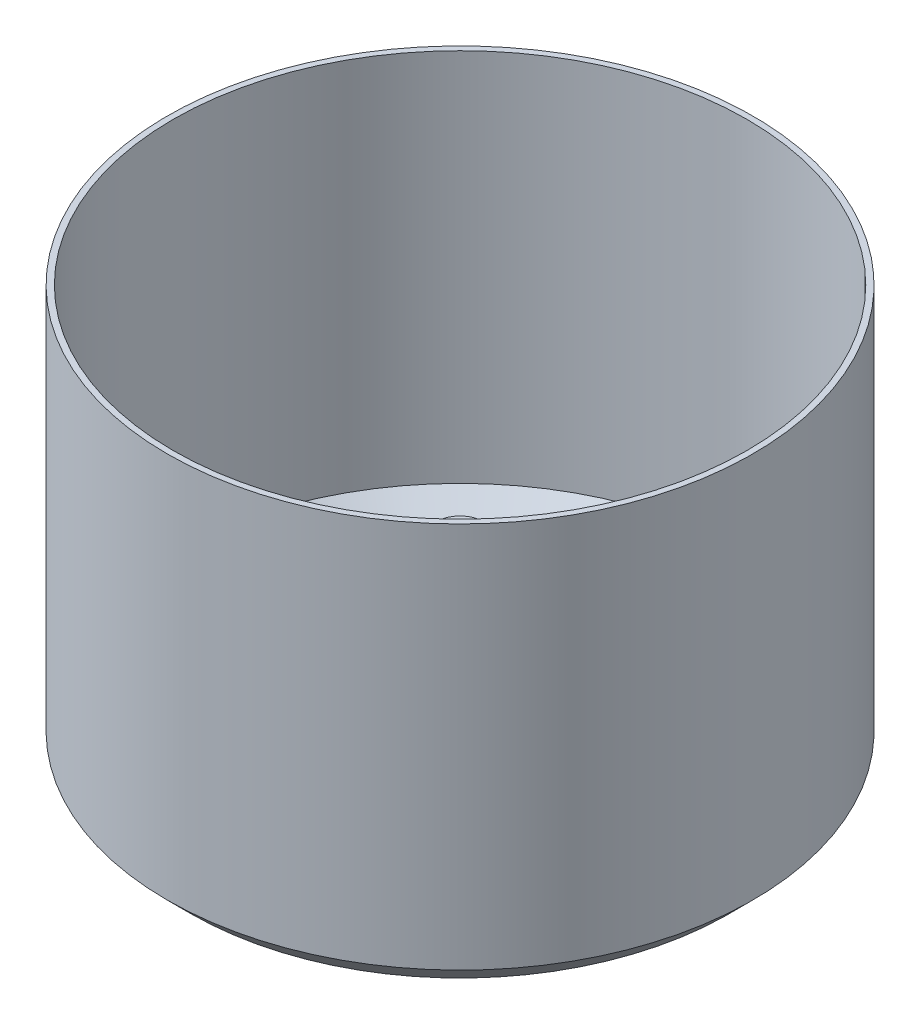
from build123d import *

# Parameters (mm, degrees)
SKETCH1_R                = 50
SKETCH1_R_2              = 49
MAIN_WALL_DEPTH          = 70
SKETCH2_R                = 50
FLOOR_2_DEPTH            = 2
INNER_FLOOR_CHAMFER_SIZE = 4
OUTER_FLOOR_CHAMFER_SIZE = 4
SKETCH3_R                = 5
CONNECTOR_PEG_DEPTH      = 10
PEG_CHAMFER_SIZE         = 1
CHAMFER1_SIZE            = 1


with BuildPart() as part:
    # Sketch1 → Main Wall (new body)
    with BuildSketch(Plane(origin=(0, 0, 0), x_dir=(1, 0, 0), z_dir=(0, 1, 0))):
        with Locations(Location((0, 0, 0), (0, 0, 270))):
            Circle(SKETCH1_R)
        with Locations(Location((0, 0, 0), (0, 0, 270))):
            Circle(SKETCH1_R_2, mode=Mode.SUBTRACT)
    extrude(amount=MAIN_WALL_DEPTH)

    # Sketch2 → Floor 2 (add)
    with BuildSketch(Plane.XZ):
        with Locations(Location((0, 0, 0), (0, 0, 90))):
            Circle(SKETCH2_R)
    extrude(amount=-FLOOR_2_DEPTH)

    # Inner Floor Chamfer
    inner_floor_chamfer_edges = [part.edges().sort_by_distance(p)[0] for p in [
        (0, 2, -49),
    ]]
    chamfer(inner_floor_chamfer_edges, length=INNER_FLOOR_CHAMFER_SIZE)

    # Outer Floor Chamfer
    outer_floor_chamfer_edges = [part.edges().sort_by_distance(p)[0] for p in [
        (0, 0, -50),
    ]]
    chamfer(outer_floor_chamfer_edges, length=OUTER_FLOOR_CHAMFER_SIZE)

    # Sketch3 → Connector Peg (add)
    with BuildSketch(Plane(origin=(0, 2, 0), x_dir=(1, 0, 0), z_dir=(0, 1, 0))):
        with Locations(Location((-21, 21, 0), (0, 0, 90))):
            Circle(SKETCH3_R)
        with Locations(Location((21, 21, 0), (0, 0, 90))):
            Circle(SKETCH3_R)
        with Locations(Location((21, -21, 0), (0, 0, 90))):
            Circle(SKETCH3_R)
        with Locations(Location((-21, -21, 0), (0, 0, 90))):
            Circle(SKETCH3_R)
    extrude(amount=CONNECTOR_PEG_DEPTH)

    # Peg Chamfer
    peg_chamfer_edges = [part.edges().sort_by_distance(p)[0] for p in [
        (-21, 12, -16),
        (21, 12, -16),
        (21, 12, 26),
        (-21, 12, 26),
    ]]
    chamfer(peg_chamfer_edges, length=PEG_CHAMFER_SIZE)

    # Chamfer1
    chamfer1_edges = [part.edges().sort_by_distance(p)[0] for p in [
        (-21, 2, -16),
        (21, 2, -16),
        (21, 2, 26),
        (-21, 2, 26),
    ]]
    chamfer(chamfer1_edges, length=CHAMFER1_SIZE)


solid = part.part
